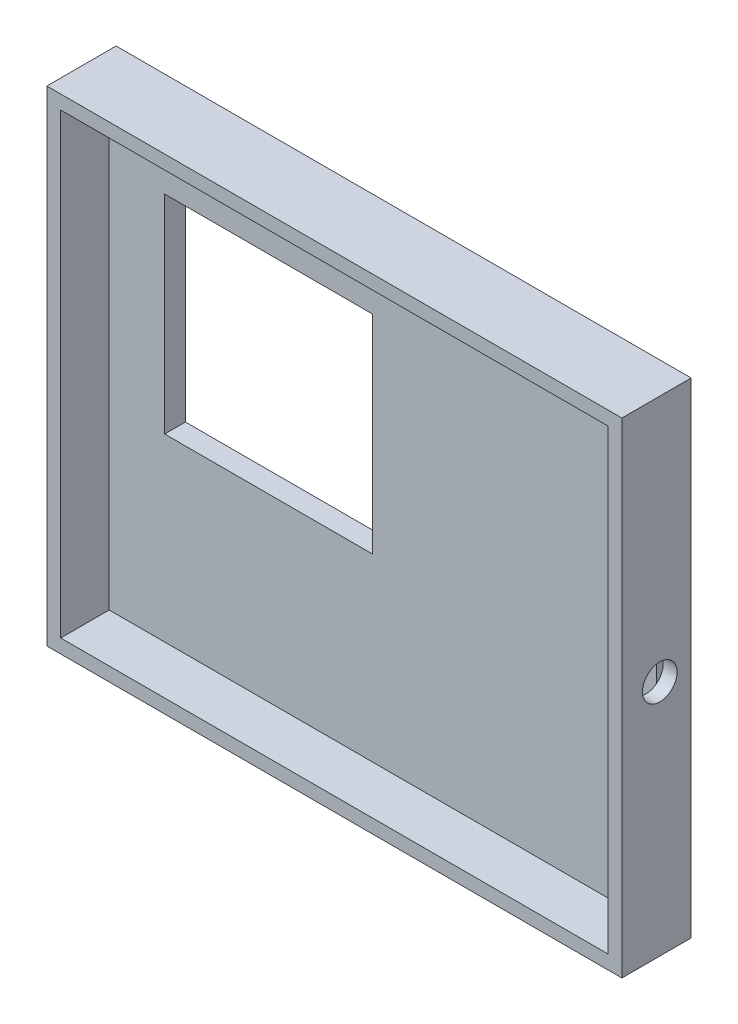
from build123d import *

# Parameters (mm, degrees)
SKETCH1_W           = 83
SKETCH1_H           = 70
BOSS_EXTRUDE1_DEPTH = 10
SKETCH3_W           = 79
SKETCH3_H           = 66
CUT_EXTRUDE1_DEPTH  = 7
SKETCH4_W           = 30
SKETCH4_H           = 30
CUT_EXTRUDE2_DEPTH  = 7
SKETCH5_R           = 2.5
CUT_EXTRUDE3_DEPTH  = 2


with BuildPart() as part:
    # Sketch1 → Boss-Extrude1 (new body)
    with BuildSketch(Plane.XY):
        with Locations((41.5, 35)):
            Rectangle(SKETCH1_W, SKETCH1_H)
    extrude(amount=BOSS_EXTRUDE1_DEPTH)

    # Sketch3 → Cut-Extrude1 (cut)
    with BuildSketch(Plane.XY.offset(10)):
        with Locations((41.5, 35)):
            Rectangle(SKETCH3_W, SKETCH3_H)
    extrude(amount=-CUT_EXTRUDE1_DEPTH, mode=Mode.SUBTRACT)

    # Sketch4 → Cut-Extrude2 (cut)
    with BuildSketch(Plane(origin=(0, 0, 0), x_dir=(-1, 0, 0), z_dir=(0, 0, -1))):
        with Locations((-25, 43)):
            Rectangle(SKETCH4_W, SKETCH4_H)
    extrude(amount=-CUT_EXTRUDE2_DEPTH, mode=Mode.SUBTRACT)

    # Sketch5 → Cut-Extrude3 (cut)
    with BuildSketch(Plane(origin=(83, 0, 0), x_dir=(0, 0, -1), z_dir=(1, 0, 0))):
        with Locations((-4.532050628, 34.280077889)):
            Circle(SKETCH5_R)
    extrude(amount=-CUT_EXTRUDE3_DEPTH, mode=Mode.SUBTRACT)


solid = part.part
